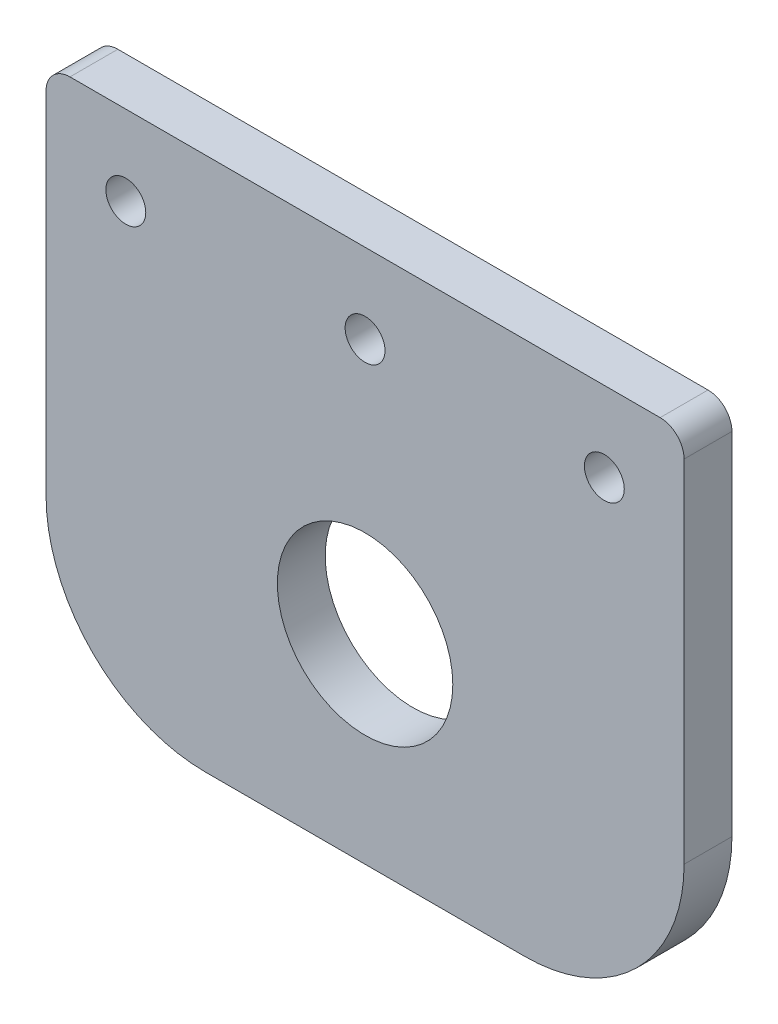
from build123d import *

# Parameters (mm, degrees)
SKETCH_1_W          = 80
SKETCH_1_H          = 67
SKETCH_1_R          = 11
EXTRUDE_1_DEPTH     = 6
SKETCH_2_R          = 2.5
CUT_EXTRUDE_1_DEPTH = 10
FILLET_1_R          = 20
FILLET_2_R          = 3


with BuildPart() as part:
    # 草图1 → 凸台-拉伸1 (new body)
    with BuildSketch(Plane.XY):
        Rectangle(SKETCH_1_W, SKETCH_1_H)
        with Locations((0, -8.5)):
            Circle(SKETCH_1_R, mode=Mode.SUBTRACT)
    extrude(amount=EXTRUDE_1_DEPTH)

    # 草图2 → 切除-拉伸1 (cut)
    with BuildSketch(Plane(origin=(0, 0, 0), x_dir=(-1, 0, 0), z_dir=(0, 0, -1))):
        with Locations((-30, 23.5)):
            Circle(SKETCH_2_R)
        with Locations((30, 23.5)):
            Circle(SKETCH_2_R)
        with Locations((0, 23.5)):
            Circle(SKETCH_2_R)
    extrude(amount=-CUT_EXTRUDE_1_DEPTH, mode=Mode.SUBTRACT)

    # 圆角1
    fillet_1_edges = [part.edges().sort_by_distance(p)[0] for p in [
        (40, -33.5, 3),
        (-40, -33.5, 3),
    ]]
    fillet(fillet_1_edges, radius=FILLET_1_R)

    # 圆角2
    fillet_2_edges = [part.edges().sort_by_distance(p)[0] for p in [
        (-40, 33.5, 3),
        (40, 33.5, 3),
    ]]
    fillet(fillet_2_edges, radius=FILLET_2_R)


solid = part.part
